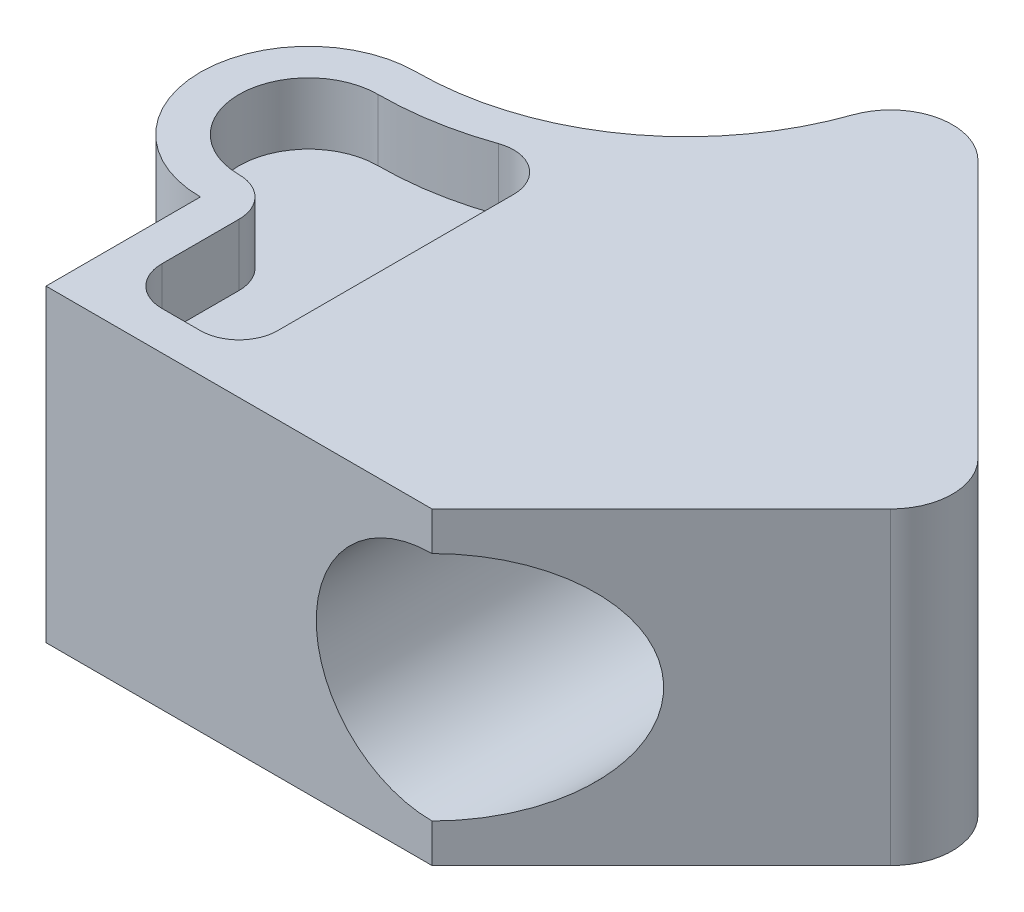
from build123d import *

# Parameters (mm, degrees)
BOSS_EXTRU_1_DEPTH      = 20
ENL_V_MAT_EXTRU_1_DEPTH = 8
ESQUISSE3_R             = 15
ESQUISSE3_R_2           = 10
ENL_V_MAT_EXTRU_2_DEPTH = 115.149577324


with BuildPart() as part:
    # Esquisse1 → Boss.-Extru.1 (new, symmetric)
    with BuildSketch(Plane(origin=(0, 0, 0), x_dir=(1, 0, 0), z_dir=(0, 1, 0))):
        with BuildLine():
            Line((0, 0), (50, 0))
            Line((50, 0), (79.69848481, 29.69848481))
            ThreePointArc((79.69848481, 29.69848481), (82.04163056, 35.355339059), (79.69848481, 41.012193309))
            Line((79.69848481, 41.012193309), (46.246943589, 74.463734529))
            ThreePointArc((46.246943589, 74.463734529), (38.809068701, 76.606108799), (33.038444811, 71.447460693))
            ThreePointArc((33.038444811, 71.447460693), (20.256617737, 54.457585283), (0, 48))
            ThreePointArc((0, 48), (-14, 34), (0, 20))
            Line((0, 20), (0, 0))
        make_face()
    extrude(amount=BOSS_EXTRU_1_DEPTH, both=True)

    # Esquisse2 → Enlèv. mat.-Extru.1 (cut)
    with BuildSketch(Plane(origin=(0, 20, 0), x_dir=(1, 0, 0), z_dir=(0, 1, 0))):
        with BuildLine():
            Line((20, 40.573593129), (20, 10))
            ThreePointArc((20, 10), (18.535533906, 6.464466094), (15, 5))
            Line((15, 5), (10, 5))
            ThreePointArc((10, 5), (6.464466094, 6.464466094), (5, 10))
            Line((5, 10), (5, 20))
            ThreePointArc((5, 20), (3.535533906, 23.535533906), (0, 25))
            ThreePointArc((0, 25), (-9, 34), (0, 43))
            ThreePointArc((0, 43), (6.764079149, 43.576057614), (13.333333333, 45.287638337))
            ThreePointArc((13.333333333, 45.287638337), (17.886751346, 44.656076033), (20, 40.573593129))
        make_face()
    extrude(amount=-ENL_V_MAT_EXTRU_1_DEPTH, mode=Mode.SUBTRACT)

    # Esquisse3 → Enlèv. mat.-Extru.2 (cut, through all)
    with BuildSketch(Plane.XY):
        with Locations(Location((50, 0, 0), (0, 0, 270))):
            Circle(ESQUISSE3_R)
        with Locations((-14, 0)):
            Circle(ESQUISSE3_R_2)
    extrude(amount=-ENL_V_MAT_EXTRU_2_DEPTH, mode=Mode.SUBTRACT)


solid = part.part
